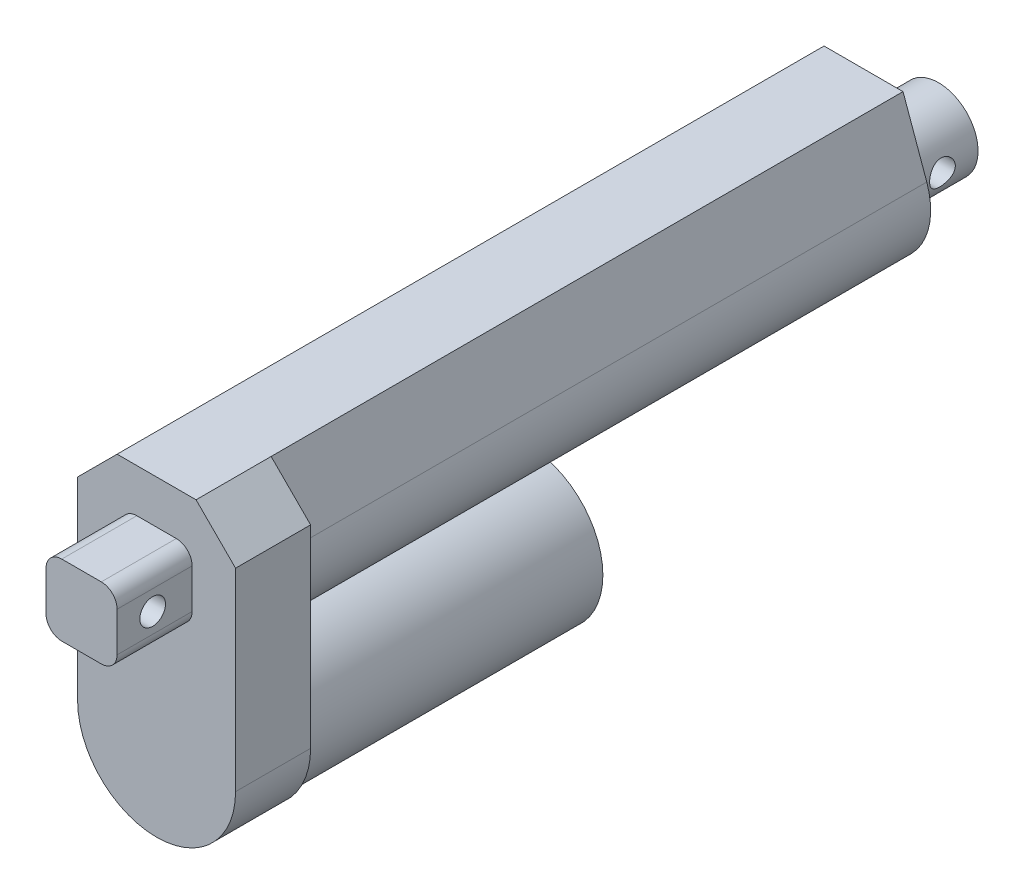
from build123d import *

# Parameters (mm, degrees)
EXTRUDE_1_DEPTH          = 19
EXTRUDE_2_DEPTH          = 160
EXTRUDE_START            = 160
SKETCH_2_3_R             = 10
EXTRUDE_3_DEPTH          = 19
CUT_EXTRUDE_1_DEPTH      = 208.569265548
CUT_EXTRUDE_1_DEPTH_BACK = 208.569265548
SKETCH_3_R               = 3.25
SKETCH_4_R               = 19
EXTRUDE_4_DEPTH          = 75
SKETCH_5_W               = 18
SKETCH_5_H               = 18
EXTRUDE_5_DEPTH          = 19
FILLET_1_R               = 4
SKETCH_6_R               = 3.25
CUT_EXTRUDE_2_DEPTH      = 209.628857159


with BuildPart() as part:
    # 스케치1 → 보스-돌출1 (new body)
    with BuildSketch(Plane.XY):
        with BuildLine():
            Line((-20, 49), (-20, 0))
            ThreePointArc((-20, 0), (0, -20), (20, 0))
            Line((20, 0), (20, 49))
            Line((20, 49), (10, 59))
            Line((10, 59), (-10, 59))
            Line((-10, 59), (-20, 49))
        make_face()
    extrude(amount=-EXTRUDE_1_DEPTH)

    # 스케치2 → 보스-돌출2 (add)
    with BuildSketch(Plane(origin=(0, 0, -19), x_dir=(-1, 0, 0), z_dir=(0, 0, -1))):
        with BuildLine():
            Line((10, 59), (-10, 59))
            Line((-10, 59), (-16.009113575, 42.179115539))
            ThreePointArc((-16.009113575, 42.179115539), (0, 19.46), (16.009113575, 42.179115539))
            Line((16.009113575, 42.179115539), (10, 59))
        make_face()
    extrude(amount=EXTRUDE_2_DEPTH)

    # 스케치2<3> → 보스-돌출3 (add)
    with BuildSketch(Plane(origin=(0, 0, -19), x_dir=(-1, 0, 0), z_dir=(0, 0, -1)).offset(EXTRUDE_START)):
        with Locations((0, 36.46)):
            Circle(SKETCH_2_3_R)
    extrude(amount=EXTRUDE_3_DEPTH)

    # 스케치3 → 컷-돌출1 (cut, two sides: drawn at the far end of the back side and taken through both)
    with BuildSketch(Plane(origin=(0, 0, 0), x_dir=(0, 0, -1), z_dir=(1, 0, 0)).offset(-CUT_EXTRUDE_1_DEPTH_BACK)):
        with Locations((189, 36)):
            Circle(SKETCH_3_R)
    extrude(amount=CUT_EXTRUDE_1_DEPTH + CUT_EXTRUDE_1_DEPTH_BACK, mode=Mode.SUBTRACT)

    # 스케치4 → 보스-돌출4 (add)
    with BuildSketch(Plane(origin=(0, 0, -19), x_dir=(-1, 0, 0), z_dir=(0, 0, -1))):
        Circle(SKETCH_4_R)
    extrude(amount=EXTRUDE_4_DEPTH)

    # 스케치5 → 보스-돌출5 (add)
    with BuildSketch(Plane.XY):
        with Locations((0, 39)):
            Rectangle(SKETCH_5_W, SKETCH_5_H)
    extrude(amount=EXTRUDE_5_DEPTH)

    # 필렛1
    fillet_1_edges = [part.edges().sort_by_distance(p)[0] for p in [
        (-9, 30, 9.5),
        (9, 30, 9.5),
        (-9, 48, 9.5),
        (9, 48, 9.5),
    ]]
    fillet(fillet_1_edges, radius=FILLET_1_R)

    # 스케치6 → 컷-돌출2 (cut, through all)
    with BuildSketch(Plane.ZY.offset(9)):
        with Locations((10, 39)):
            Circle(SKETCH_6_R)
    extrude(amount=-CUT_EXTRUDE_2_DEPTH, mode=Mode.SUBTRACT)


solid = part.part
